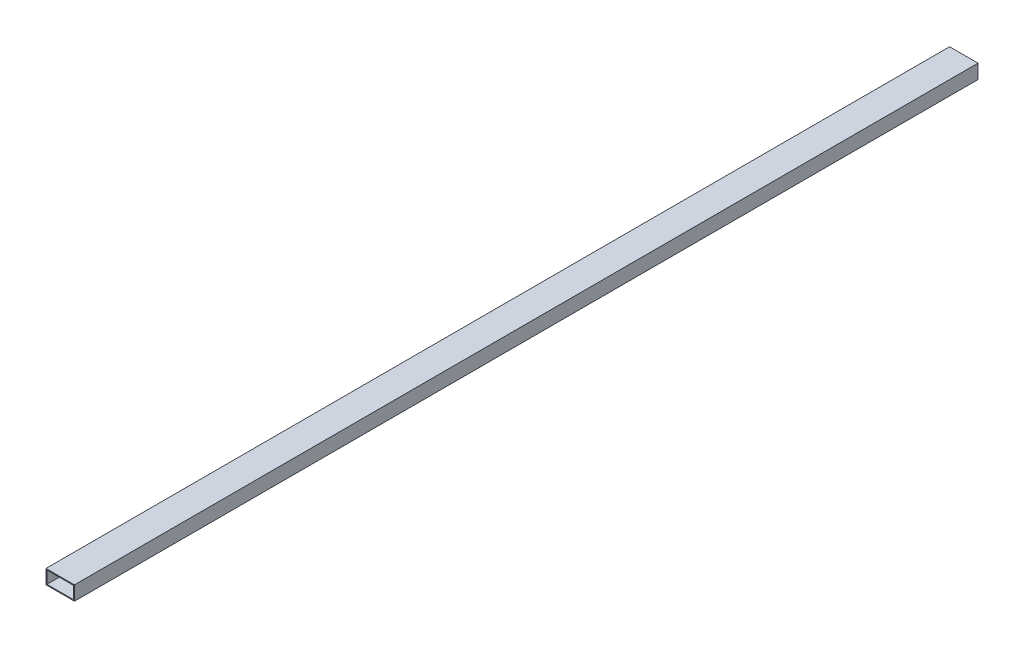
from build123d import *

# Parameters (mm, degrees)
SKETCH_1_W      = 30
SKETCH_1_H      = 15
SKETCH_1_W_2    = 28
SKETCH_1_H_2    = 13
EXTRUDE_1_DEPTH = 953


with BuildPart() as part:
    # 草图1 → 凸台-拉伸1 (new body)
    with BuildSketch(Plane.XY):
        with Locations((15, 7.5)):
            Rectangle(SKETCH_1_W, SKETCH_1_H)
        with Locations((15, 7.5)):
            Rectangle(SKETCH_1_W_2, SKETCH_1_H_2, mode=Mode.SUBTRACT)
    extrude(amount=EXTRUDE_1_DEPTH)


solid = part.part
